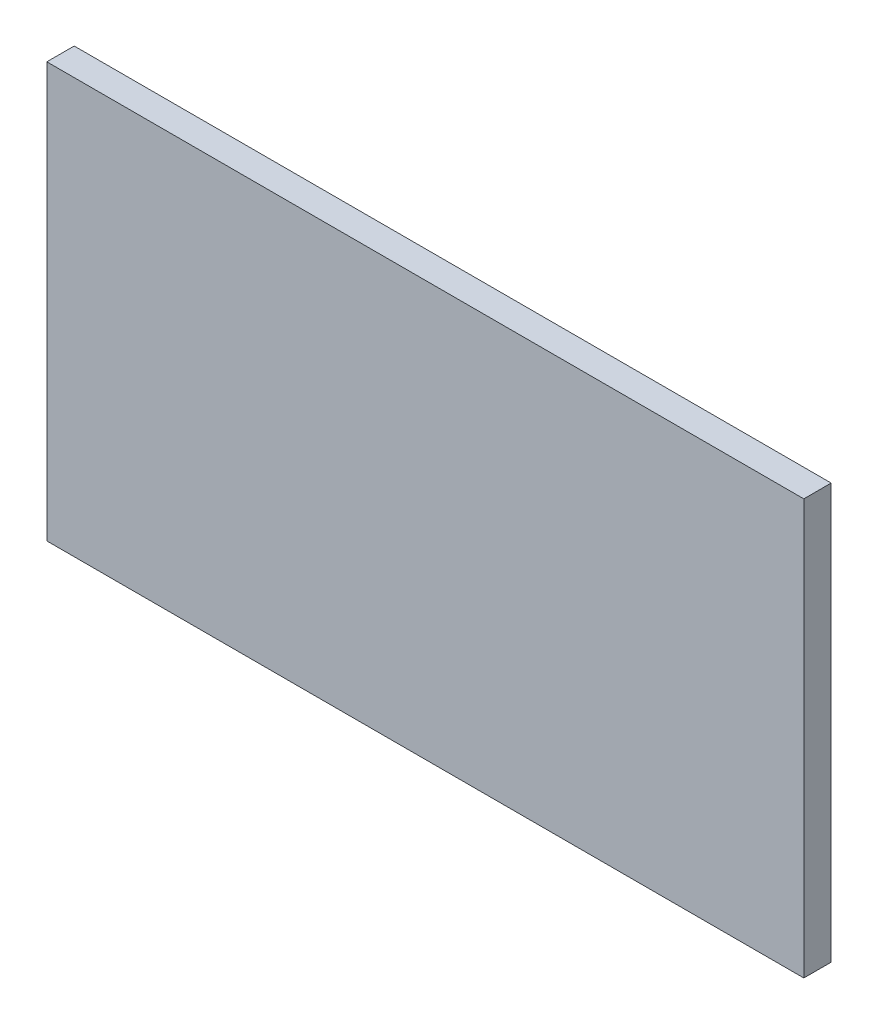
from build123d import *

# Parameters (mm, degrees)
SKETCH1_W             = 41.5
SKETCH1_H             = 22.75
BOSS_EXTRUDE1_DEPTH   = 1.5
SKETCH2_W             = 3.76
SKETCH2_H             = 3
BOSS_EXTRUDE3_DEPTH   = 1.1
SKETCH3_R             = 0.25
CUT_EXTRUDE1_DEPTH    = 0.5
FILLET3_R             = 0.5
SKETCH4_R             = 0.65
BOSS_EXTRUDE6_DEPTH   = 0.25
BOSS_EXTRUDE6_2_DEPTH = 0.25
BOSS_EXTRUDE6_3_DEPTH = 0.25
BOSS_EXTRUDE6_4_DEPTH = 0.25
BOSS_EXTRUDE6_5_DEPTH = 0.25
BOSS_EXTRUDE6_6_DEPTH = 0.25


with BuildPart() as part:
    # Sketch1 → Boss-Extrude1 (new body)
    with BuildSketch(Plane.XY):
        with Locations((20.75, 11.375)):
            Rectangle(SKETCH1_W, SKETCH1_H)
    extrude(amount=BOSS_EXTRUDE1_DEPTH)

    # Sketch2 → Boss-Extrude3 (add)
    with BuildSketch(Plane(origin=(0, 0, 0), x_dir=(-1, 0, 0), z_dir=(0, 0, -1))):
        with Locations((-7.38, 13.75)):
            Rectangle(SKETCH2_W, SKETCH2_H)
    extrude(amount=BOSS_EXTRUDE3_DEPTH)

    # Sketch3 → Cut-Extrude1 (cut)
    with BuildSketch(Plane(origin=(0, 0, -1.1), x_dir=(-1, 0, 0), z_dir=(0, 0, -1))):
        with Locations((-8.08, 13.75)):
            Circle(SKETCH3_R)
    extrude(amount=-CUT_EXTRUDE1_DEPTH, mode=Mode.SUBTRACT)

    # Fillet3
    fillet3_edges = [part.edges().sort_by_distance(p)[0] for p in [
        (9.26, 13.75, -1.1),
        (7.38, 15.25, -1.1),
        (5.5, 13.75, -1.1),
        (7.38, 12.25, -1.1),
    ]]
    fillet(fillet3_edges, radius=FILLET3_R)


with BuildPart() as body_2:
    # Sketch4 → Boss-Extrude6 (new body)
    with BuildSketch(Plane(origin=(0, 0, 0), x_dir=(-1, 0, 0), z_dir=(0, 0, -1))):
        with Locations((-23.25, 3.3)):
            Circle(SKETCH4_R)
    extrude(amount=BOSS_EXTRUDE6_DEPTH)


with BuildPart() as body_3:
    # Sketch4 → Boss-Extrude6 2 (new body)
    with BuildSketch(Plane(origin=(0, 0, 0), x_dir=(-1, 0, 0), z_dir=(0, 0, -1))):
        with Locations((-23.25, 5.05)):
            Circle(SKETCH4_R)
    extrude(amount=BOSS_EXTRUDE6_2_DEPTH)


with BuildPart() as body_4:
    # Sketch4 → Boss-Extrude6 3 (new body)
    with BuildSketch(Plane(origin=(0, 0, 0), x_dir=(-1, 0, 0), z_dir=(0, 0, -1))):
        with Locations((-23.25, 6.8)):
            Circle(SKETCH4_R)
    extrude(amount=BOSS_EXTRUDE6_3_DEPTH)


with BuildPart() as body_5:
    # Sketch4 → Boss-Extrude6 4 (new body)
    with BuildSketch(Plane(origin=(0, 0, 0), x_dir=(-1, 0, 0), z_dir=(0, 0, -1))):
        with Locations((-21.5, 3.3)):
            Circle(SKETCH4_R)
    extrude(amount=BOSS_EXTRUDE6_4_DEPTH)


with BuildPart() as body_6:
    # Sketch4 → Boss-Extrude6 5 (new body)
    with BuildSketch(Plane(origin=(0, 0, 0), x_dir=(-1, 0, 0), z_dir=(0, 0, -1))):
        with Locations((-21.5, 5.05)):
            Circle(SKETCH4_R)
    extrude(amount=BOSS_EXTRUDE6_5_DEPTH)


with BuildPart() as body_7:
    # Sketch4 → Boss-Extrude6 6 (new body)
    with BuildSketch(Plane(origin=(0, 0, 0), x_dir=(-1, 0, 0), z_dir=(0, 0, -1))):
        with Locations((-21.5, 6.8)):
            Circle(SKETCH4_R)
    extrude(amount=BOSS_EXTRUDE6_6_DEPTH)


solid = Compound([part.part, body_2.part, body_3.part, body_4.part, body_5.part, body_6.part, body_7.part])
